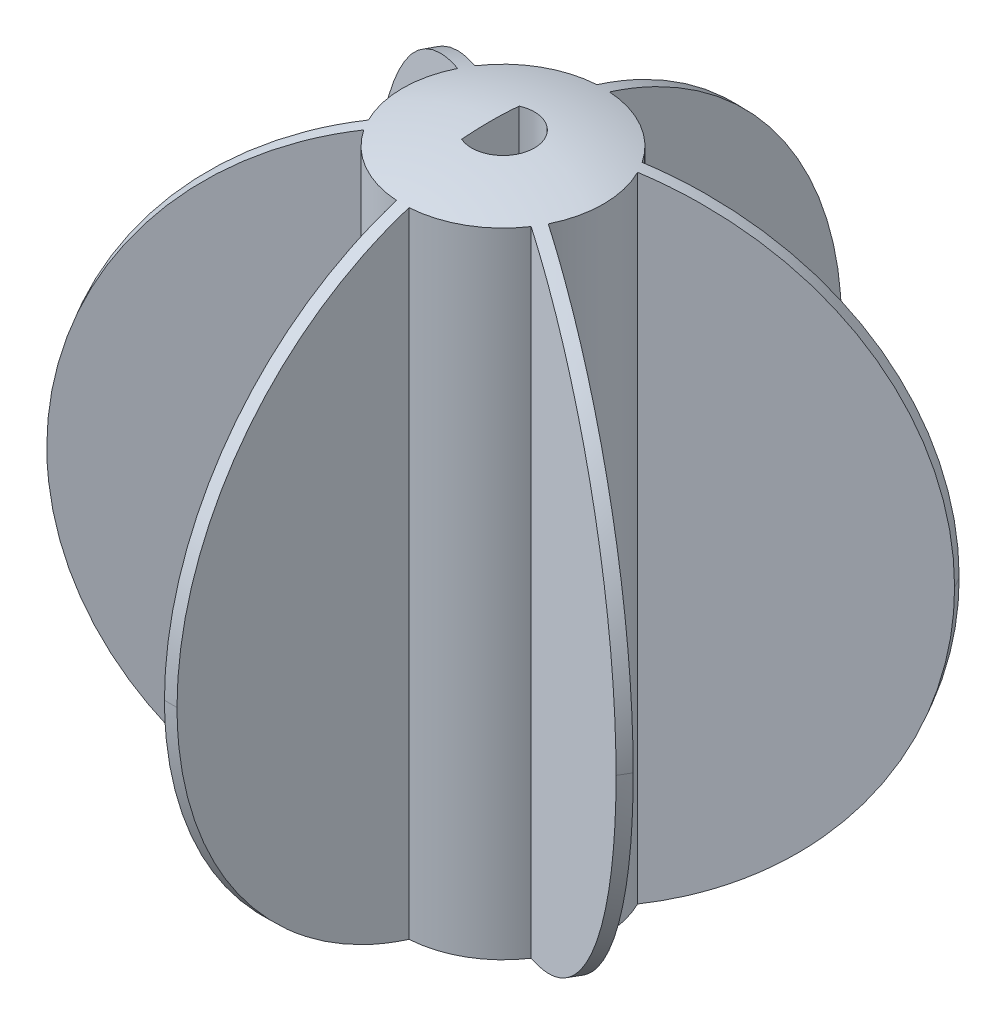
from build123d import *

# Parameters (mm, degrees)
BOSS_EXTRUDE1_DEPTH             = 84.074
SKETCH6_R                       = 3.96875
BOSS_EXTRUDE3_DEPTH             = 2.38125
BOSS_EXTRUDE3_DIRECTION_2_REACH = 112.162
CUT_EXTRUDE2_START              = 12.7
CUT_EXTRUDE2_DEPTH              = 127


with BuildPart() as part:
    # Sketch1 → Boss-Extrude1 (new body)
    with BuildSketch(Plane(origin=(0, 0, 0), x_dir=(1, 0, 0), z_dir=(0, 1, 0))):
        with BuildLine():
            Line((-2.026115743, 3.016087065), (-11.812510862, -2.634090791))
            Line((-11.812510862, -2.634090791), (-2.026115743, -8.284268648))
            ThreePointArc((-2.026115743, -8.284268648), (-1.035981017, -5.535946403), (-0.700010862, -2.634090791))
            ThreePointArc((-0.700010862, -2.634090791), (-1.035981017, 0.26776482), (-2.026115743, 3.016087065))
        make_face()
        with BuildLine():
            Line((-12.606260862, 10.04108025), (-12.606260862, -1.259275463))
            Line((-12.606260862, -1.259275463), (-2.819865743, 4.390902394))
            ThreePointArc((-2.819865743, 4.390902394), (-7.050010862, 8.364431837), (-12.606260862, 10.04108025))
        make_face()
        with BuildLine():
            Line((-23.980155982, 4.390902394), (-14.193760862, -1.259275463))
            Line((-14.193760862, -1.259275463), (-14.193760862, 10.04108025))
            ThreePointArc((-14.193760862, 10.04108025), (-19.750010862, 8.364431837), (-23.980155982, 4.390902394))
        make_face()
        with BuildLine():
            Line((-24.773905982, -8.284268648), (-14.987510862, -2.634090791))
            Line((-14.987510862, -2.634090791), (-24.773905982, 3.016087065))
            ThreePointArc((-24.773905982, 3.016087065), (-26.100010862, -2.634090791), (-24.773905982, -8.284268648))
        make_face()
        with BuildLine():
            ThreePointArc((-23.980155982, -9.659083976), (-19.750010862, -13.632613419), (-14.193760862, -15.309261833))
            Line((-14.193760862, -15.309261833), (-14.193760862, -4.00890612))
            Line((-14.193760862, -4.00890612), (-23.980155982, -9.659083976))
        make_face()
        with BuildLine():
            Line((-12.606260862, -4.00890612), (-12.606260862, -15.309261833))
            ThreePointArc((-12.606260862, -15.309261833), (-7.050010862, -13.632613419), (-2.819865743, -9.659083976))
            Line((-2.819865743, -9.659083976), (-12.606260862, -4.00890612))
        make_face()
        with BuildLine():
            Line((-13.400010862, 10.065909209), (-13.400010862, -1.717547239))
            Line((-13.400010862, -1.717547239), (-12.606260862, -1.259275463))
            Line((-12.606260862, -1.259275463), (-12.606260862, 10.04108025))
            ThreePointArc((-12.606260862, 10.04108025), (-13.002941744, 10.059700451), (-13.400010862, 10.065909209))
        make_face()
        with BuildLine():
            Line((-14.193760862, -1.259275463), (-13.400010862, -1.717547239))
            Line((-13.400010862, -1.717547239), (-13.400010862, 10.065909209))
            ThreePointArc((-13.400010862, 10.065909209), (-13.797079981, 10.059700451), (-14.193760862, 10.04108025))
            Line((-14.193760862, 10.04108025), (-14.193760862, -1.259275463))
        make_face()
        with BuildLine():
            Line((-24.39853349, 3.715909209), (-14.193760862, -2.175819015))
            Line((-14.193760862, -2.175819015), (-14.193760862, -1.259275463))
            Line((-14.193760862, -1.259275463), (-23.980155982, 4.390902394))
            ThreePointArc((-23.980155982, 4.390902394), (-24.194621989, 4.056676774), (-24.39853349, 3.715909209))
        make_face()
        with BuildLine():
            Line((-14.987510862, -2.634090791), (-14.193760862, -2.175819015))
            Line((-14.193760862, -2.175819015), (-24.39853349, 3.715909209))
            ThreePointArc((-24.39853349, 3.715909209), (-24.591691108, 3.368932886), (-24.773905982, 3.016087065))
            Line((-24.773905982, 3.016087065), (-14.987510862, -2.634090791))
        make_face()
        with BuildLine():
            Line((-12.606260862, -1.259275463), (-12.606260862, -2.175819015))
            Line((-12.606260862, -2.175819015), (-2.401488234, 3.715909209))
            ThreePointArc((-2.401488234, 3.715909209), (-2.605399735, 4.056676774), (-2.819865743, 4.390902394))
            Line((-2.819865743, 4.390902394), (-12.606260862, -1.259275463))
        make_face()
        with BuildLine():
            Line((-2.401488234, 3.715909209), (-12.606260862, -2.175819015))
            Line((-12.606260862, -2.175819015), (-11.812510862, -2.634090791))
            Line((-11.812510862, -2.634090791), (-2.026115743, 3.016087065))
            ThreePointArc((-2.026115743, 3.016087065), (-2.208330616, 3.368932886), (-2.401488234, 3.715909209))
        make_face()
        with BuildLine():
            Line((-13.400010862, -3.550634344), (-13.400010862, -15.334090791))
            ThreePointArc((-13.400010862, -15.334090791), (-13.002941744, -15.327882034), (-12.606260862, -15.309261833))
            Line((-12.606260862, -15.309261833), (-12.606260862, -4.00890612))
            Line((-12.606260862, -4.00890612), (-13.400010862, -3.550634344))
        make_face()
        with BuildLine():
            ThreePointArc((-14.193760862, -15.309261833), (-13.797079981, -15.327882034), (-13.400010862, -15.334090791))
            Line((-13.400010862, -15.334090791), (-13.400010862, -3.550634344))
            Line((-13.400010862, -3.550634344), (-14.193760862, -4.00890612))
            Line((-14.193760862, -4.00890612), (-14.193760862, -15.309261833))
        make_face()
        with BuildLine():
            Line((-24.39853349, -8.984090791), (-14.193760862, -3.092362568))
            Line((-14.193760862, -3.092362567), (-14.987510862, -2.634090791))
            Line((-14.987510862, -2.634090791), (-24.773905982, -8.284268648))
            ThreePointArc((-24.773905982, -8.284268648), (-24.591691108, -8.637114469), (-24.39853349, -8.984090791))
        make_face()
        with BuildLine():
            Line((-23.980155982, -9.659083976), (-14.193760862, -4.00890612))
            Line((-14.193760862, -4.00890612), (-14.193760862, -3.092362567))
            Line((-14.193760862, -3.092362568), (-24.39853349, -8.984090791))
            ThreePointArc((-24.39853349, -8.984090791), (-24.194621989, -9.324858356), (-23.980155982, -9.659083976))
        make_face()
        with BuildLine():
            Line((-2.401488234, -8.984090791), (-12.606260862, -3.092362567))
            Line((-12.606260862, -3.092362568), (-12.606260862, -4.00890612))
            Line((-12.606260862, -4.00890612), (-2.819865743, -9.659083976))
            ThreePointArc((-2.819865743, -9.659083976), (-2.605399735, -9.324858356), (-2.401488234, -8.984090791))
        make_face()
        with BuildLine():
            Line((-11.812510862, -2.634090791), (-12.606260862, -3.092362568))
            Line((-12.606260862, -3.092362567), (-2.401488234, -8.984090791))
            ThreePointArc((-2.401488234, -8.984090791), (-2.208330616, -8.637114469), (-2.026115743, -8.284268648))
            Line((-2.026115743, -8.284268648), (-11.812510862, -2.634090791))
        make_face()
        Polygon((-12.606260862, -1.259275463), (-13.400010862, -1.717547239), (-12.606260862, -2.175819015), align=None)
        Polygon((-13.400010862, -1.717547239), (-13.400010862, -2.634090791), (-12.606260862, -2.175819015), align=None)
        Polygon((-14.193760862, -2.175819015), (-13.400010862, -2.634090791), (-13.400010862, -1.717547239), align=None)
        Polygon((-14.193760862, -2.175819015), (-13.400010862, -1.717547239), (-14.193760862, -1.259275463), align=None)
        Polygon((-14.987510862, -2.634090791), (-14.193760862, -3.092362567), (-14.193760862, -2.175819015), align=None)
        Polygon((-14.193760862, -3.092362568), (-13.400010862, -2.634090791), (-14.193760862, -2.175819015), align=None)
        Polygon((-14.193760862, -3.092362567), (-13.400010862, -3.550634344), (-13.400010862, -2.634090791), align=None)
        Polygon((-13.400010862, -2.634090791), (-13.400010862, -3.550634344), (-12.606260862, -3.092362568), align=None)
        Polygon((-12.606260862, -2.175819015), (-13.400010862, -2.634090791), (-12.606260862, -3.092362567), align=None)
        Polygon((-12.606260862, -2.175819015), (-12.606260862, -3.092362568), (-11.812510862, -2.634090791), align=None)
        Polygon((-12.606260862, -3.092362568), (-13.400010862, -3.550634344), (-12.606260862, -4.00890612), align=None)
        Polygon((-14.193760862, -4.00890612), (-13.400010862, -3.550634344), (-14.193760862, -3.092362567), align=None)
        with BuildLine():
            Line((-2.819865743, -9.659083976), (22.601733582, -24.33625119))
            ThreePointArc((22.601733582, -24.33625119), (22.805030042, -23.995373106), (23.005099037, -23.652590791))
            Line((23.005099037, -23.652590791), (-2.401488234, -8.984090791))
            ThreePointArc((-2.401488234, -8.984090791), (-2.605399735, -9.324858356), (-2.819865743, -9.659083976))
        make_face()
        with BuildLine():
            ThreePointArc((-24.773905982, 3.016087065), (-24.591691108, 3.368932886), (-24.39853349, 3.715909209))
            Line((-24.39853349, 3.715909209), (-49.805120761, 18.384409209))
            ThreePointArc((-49.805120761, 18.384409209), (-50.001944456, 18.039753219), (-50.195505306, 17.693254279))
            Line((-50.195505306, 17.693254279), (-24.773905982, 3.016087065))
        make_face()
        with BuildLine():
            Line((-2.401488234, -8.984090791), (23.005099037, -23.652590791))
            ThreePointArc((23.005099037, -23.652590791), (23.201922732, -23.307934802), (23.395483582, -22.961435861))
            Line((23.395483582, -22.961435861), (-2.026115743, -8.284268648))
            ThreePointArc((-2.026115743, -8.284268648), (-2.208330616, -8.637114469), (-2.401488234, -8.984090791))
        make_face()
        with BuildLine():
            Line((-49.805120761, 18.384409209), (-24.39853349, 3.715909209))
            ThreePointArc((-24.39853349, 3.715909209), (-24.194621989, 4.056676774), (-23.980155982, 4.390902394))
            Line((-23.980155982, 4.390902394), (-49.401755306, 19.068069607))
            ThreePointArc((-49.401755306, 19.068069607), (-49.605051766, 18.727191524), (-49.805120761, 18.384409209))
        make_face()
        with BuildLine():
            Line((-13.400010862, -15.334090791), (-13.400010862, -44.671090791))
            ThreePointArc((-13.400010862, -44.671090791), (-13.003118172, -44.669217117), (-12.606260862, -44.66359626))
            Line((-12.606260862, -44.66359626), (-12.606260862, -15.309261833))
            ThreePointArc((-12.606260862, -15.309261833), (-13.002941744, -15.327882034), (-13.400010862, -15.334090791))
        make_face()
        with BuildLine():
            Line((-13.400010862, 39.402909209), (-13.400010862, 10.065909209))
            ThreePointArc((-13.400010862, 10.065909209), (-13.002941744, 10.059700451), (-12.606260862, 10.04108025))
            Line((-12.606260862, 10.04108025), (-12.606260862, 39.395414677))
            ThreePointArc((-12.606260862, 39.395414677), (-13.003118172, 39.401035534), (-13.400010862, 39.402909209))
        make_face()
        with BuildLine():
            ThreePointArc((-14.193760862, -44.66359626), (-13.796903552, -44.669217117), (-13.400010862, -44.671090791))
            Line((-13.400010862, -44.671090791), (-13.400010862, -15.334090791))
            ThreePointArc((-13.400010862, -15.334090791), (-13.797079981, -15.327882034), (-14.193760862, -15.309261833))
            Line((-14.193760862, -15.309261833), (-14.193760862, -44.66359626))
        make_face()
        with BuildLine():
            ThreePointArc((-14.193760862, 10.04108025), (-13.797079981, 10.059700451), (-13.400010862, 10.065909209))
            Line((-13.400010862, 10.065909209), (-13.400010862, 39.402909209))
            ThreePointArc((-13.400010862, 39.402909209), (-13.796903552, 39.401035534), (-14.193760862, 39.395414677))
            Line((-14.193760862, 39.395414677), (-14.193760862, 10.04108025))
        make_face()
        with BuildLine():
            ThreePointArc((-49.805120761, -23.652590791), (-49.605051766, -23.995373106), (-49.401755306, -24.33625119))
            Line((-49.401755306, -24.33625119), (-23.980155982, -9.659083976))
            ThreePointArc((-23.980155982, -9.659083976), (-24.194621989, -9.324858356), (-24.39853349, -8.984090791))
            Line((-24.39853349, -8.984090791), (-49.805120761, -23.652590791))
        make_face()
        with BuildLine():
            Line((23.005099037, 18.384409209), (-2.401488234, 3.715909209))
            ThreePointArc((-2.401488234, 3.715909209), (-2.208330616, 3.368932886), (-2.026115743, 3.016087065))
            Line((-2.026115743, 3.016087065), (23.395483582, 17.693254279))
            ThreePointArc((23.395483582, 17.693254279), (23.201922732, 18.039753219), (23.005099037, 18.384409209))
        make_face()
        with BuildLine():
            ThreePointArc((-50.195505306, -22.961435861), (-50.001944456, -23.307934802), (-49.805120761, -23.652590791))
            Line((-49.805120761, -23.652590791), (-24.39853349, -8.984090791))
            ThreePointArc((-24.39853349, -8.984090791), (-24.591691108, -8.637114469), (-24.773905982, -8.284268648))
            Line((-24.773905982, -8.284268648), (-50.195505306, -22.961435861))
        make_face()
        with BuildLine():
            ThreePointArc((-2.819865743, 4.390902394), (-2.605399735, 4.056676774), (-2.401488234, 3.715909209))
            Line((-2.401488234, 3.715909209), (23.005099037, 18.384409209))
            ThreePointArc((23.005099037, 18.384409209), (22.805030042, 18.727191524), (22.601733582, 19.068069607))
            Line((22.601733582, 19.068069607), (-2.819865743, 4.390902394))
        make_face()
    extrude(amount=BOSS_EXTRUDE1_DEPTH)

    # Sketch5 → Cut-Revolve6 (revolve, cut)
    with BuildSketch(Plane(origin=(-4.490597486, 0, 7.777943002), x_dir=(0.8660254037844362, 0, 0.5000000000000044), z_dir=(-0.5000000000000044, 0, 0.8660254037844362)), mode=Mode.PRIVATE) as cut_revolve6_sk:
        with BuildLine():
            ThreePointArc((-10.287704422, 84.074), (19.43429374, 71.761193064), (31.741801047, 42.037))
            ThreePointArc((31.741801047, 42.037), (19.429903316, 12.317196578), (-10.287704422, 0))
            Line((-10.287704422, 0), (-10.287704422, -11.787361723))
            Line((-10.287704422, -11.787361723), (48.48726739, -11.787361723))
            Line((48.48726739, -11.787361723), (48.48726739, 96.808011899))
            Line((48.48726739, 96.808011899), (-10.287704422, 96.808011899))
            Line((-10.287704422, 96.808011899), (-10.287704422, 84.074))
        make_face()
    revolve(cut_revolve6_sk.sketch.rotate(Axis((-13.400010862, 84.074, 2.634090791), (0, -1, 0)), 180), axis=Axis((-13.400010862, 84.074, 2.634090791), (0, -1, 0)), mode=Mode.SUBTRACT)

    # Sketch6 → Boss-Extrude3 (add)
    with BuildSketch(Plane(origin=(0, 0, 0), x_dir=(1, 0, 0), z_dir=(0, 1, 0))):
        with Locations(Location((-13.400010862, -2.634090791, 0), (0, 0, 270))):
            Circle(SKETCH6_R)
    extrude(amount=-BOSS_EXTRUDE3_DEPTH)

    # Sketch6 → Boss-Extrude3 direction 2 (add, up to next)
    with BuildSketch(Plane(origin=(0, 0, 0), x_dir=(1, 0, 0), z_dir=(0, 1, 0)), mode=Mode.PRIVATE) as boss_extrude3_direction_2_sk1:
        with Locations(Location((-13.400010862, -2.634090791, 0), (0, 0, 270))):
            Circle(SKETCH6_R)
    boss_extrude3_direction_2_tool1 = extrude(boss_extrude3_direction_2_sk1.sketch, amount=BOSS_EXTRUDE3_DIRECTION_2_REACH, mode=Mode.PRIVATE) - part.part
    add(boss_extrude3_direction_2_tool1.solids().sort_by_distance((-13.400011, 0, 2.634091))[0])

    # Sketch7 → Cut-Extrude2 (cut)
    with BuildSketch(Plane(origin=(0, 0, 0), x_dir=(1, 0, 0), z_dir=(0, 1, 0)).offset(CUT_EXTRUDE2_START)):
        with BuildLine():
            ThreePointArc((-9.431260862, -2.634090791), (-11.226236962, 0.686403689), (-14.987510862, 1.003328667))
            Line((-14.987510862, 1.003328667), (-14.987510862, -2.634090791))
            Line((-14.987510862, -2.634090791), (-9.431260862, -2.634090791))
        make_face()
        with BuildLine():
            Line((-9.431260862, -2.634090791), (-14.987510862, -2.634090791))
            Line((-14.987510862, -2.634090791), (-14.987510862, -6.271510249))
            ThreePointArc((-14.987510862, -6.271510249), (-11.226236962, -5.954585272), (-9.431260862, -2.634090791))
        make_face()
    extrude(amount=CUT_EXTRUDE2_DEPTH, mode=Mode.SUBTRACT)


solid = part.part
